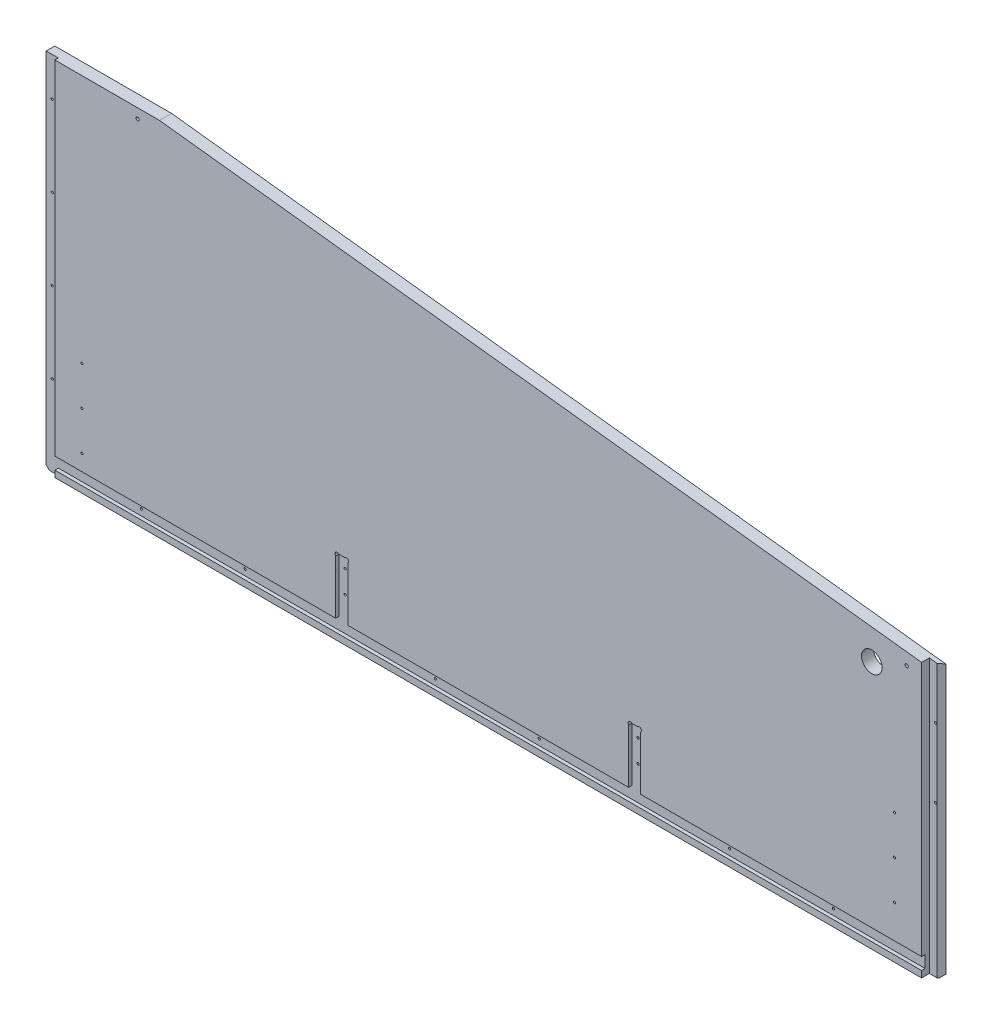
from build123d import *

# Parameters (mm, degrees)
EXTRUDE2_DEPTH     = 17.78
CUT_EXTRUDE3_DEPTH = 5.08
SKETCH9_R          = 3.301999998
SKETCH9_R_2        = 3.174999998
SKETCH9_R_3        = 3.174999999
CUT_EXTRUDE4_DEPTH = 5.08
SKETCH10_R         = 15.08125
SKETCH10_R_2       = 1.5875
CUT_EXTRUDE5_DEPTH = 17.78
SKETCH11_W         = 17.78
SKETCH11_H         = 401.3161961
CUT_EXTRUDE6_DEPTH = 11.43
CUT_EXTRUDE8_REACH = 10238.765
SKETCH15_R         = 2.38125
CUT_EXTRUDE9_DEPTH = 17.78


with BuildPart() as part:
    # Sketch7 → Extrude2 (new body)
    with BuildSketch(Plane.XY):
        Polygon((9086.320833334, -4722.091838581), (10222.970833334, -4853.78125), (10222.970833334, -5248.275), (10218.208333334, -5253.0375), (8919.633333334, -5253.0375), (8914.870833334, -5248.275), (8914.870833334, -4722.091838581), align=None)
    extrude(amount=-EXTRUDE2_DEPTH)

    # Sketch8 → Cut-Extrude3 (cut)
    with BuildSketch(Plane.XY):
        Polygon((8932.650833334, -4722.091838581), (8914.870833334, -4722.091838581), (8914.870833334, -5253.0375), (8932.650833334, -5253.0375), (8932.650833334, -5243.5125), (10222.970833334, -5243.5125), (10222.970833334, -5225.7325), (9792.864166668, -5225.7325), (9792.864166668, -5141.912499999), (9775.084166668, -5141.912499999), (9775.084166668, -5225.7325), (9362.757500002, -5225.7325), (9362.757500002, -5141.9125), (9344.977500002, -5141.912499999), (9344.977500002, -5225.7325), (8932.650833334, -5225.7325), align=None)
    extrude(amount=-CUT_EXTRUDE3_DEPTH, mode=Mode.SUBTRACT)

    # Sketch9 → Cut-Extrude4 (cut)
    with BuildSketch(Plane.XY):
        with Locations((9347.222564031, -5144.157564028)):
            Circle(SKETCH9_R)
        with Locations((9360.512435973, -5144.15756403)):
            Circle(SKETCH9_R_2)
        with Locations((9777.329230699, -5144.157564029)):
            Circle(SKETCH9_R_3)
        with Locations((9790.619102638, -5144.157564029)):
            Circle(SKETCH9_R_3)
    extrude(amount=-CUT_EXTRUDE4_DEPTH, mode=Mode.SUBTRACT)

    # Sketch10 → Cut-Extrude5 (cut)
    with BuildSketch(Plane.XY):
        with Locations((10132.081036572, -4887.549352662)):
            Circle(SKETCH10_R)
        with Locations((8923.760833334, -4778.904166666)):
            Circle(SKETCH10_R_2)
        with Locations((8923.760833334, -4897.4375)):
            Circle(SKETCH10_R_2)
        with Locations((8923.760833334, -5015.970833334)):
            Circle(SKETCH10_R_2)
        with Locations((8923.760833334, -5134.504166666)):
            Circle(SKETCH10_R_2)
        with Locations((9054.570833334, -5234.6225)):
            Circle(SKETCH10_R_2)
        with Locations((9206.970833334, -5234.6225)):
            Circle(SKETCH10_R_2)
        with Locations((9353.8675, -5193.9825)):
            Circle(SKETCH10_R_2)
        with Locations((9353.8675, -5160.9625)):
            Circle(SKETCH10_R_2)
        with Locations((9486.370833334, -5234.6225)):
            Circle(SKETCH10_R_2)
        with Locations((9638.770833334, -5234.6225)):
            Circle(SKETCH10_R_2)
        with Locations((9783.974166666, -5193.9825)):
            Circle(SKETCH10_R_2)
        with Locations((9783.974166666, -5160.9625)):
            Circle(SKETCH10_R_2)
        with Locations((9918.170833334, -5234.6225)):
            Circle(SKETCH10_R_2)
        with Locations((10070.570833334, -5234.6225)):
            Circle(SKETCH10_R_2)
        with Locations((10214.080833334, -5031.58125)):
            Circle(SKETCH10_R_2)
        with Locations((10214.080833334, -4929.98125)):
            Circle(SKETCH10_R_2)
        with Locations((8972.338333334, -5087.9375)):
            Circle(SKETCH10_R_2)
        with Locations((8972.338333334, -5145.0875)):
            Circle(SKETCH10_R_2)
        with Locations((8972.338333334, -5202.2375)):
            Circle(SKETCH10_R_2)
        with Locations((10165.503333334, -5176.8375)):
            Circle(SKETCH10_R_2)
        with Locations((10165.503333334, -5119.6875)):
            Circle(SKETCH10_R_2)
        with Locations((10165.503333334, -5062.5375)):
            Circle(SKETCH10_R_2)
    extrude(amount=-CUT_EXTRUDE5_DEPTH, mode=Mode.SUBTRACT)

    # Sketch11 → Cut-Extrude6 (cut)
    with BuildSketch(Plane.XY):
        with Locations((10214.080833334, -5052.37940195)):
            Rectangle(SKETCH11_W, SKETCH11_H)
    extrude(amount=-CUT_EXTRUDE6_DEPTH, mode=Mode.SUBTRACT)

    # Cut-Extrude8: up to this plane
    cut_extrude8_end = Plane(origin=(9086.320833334, -4722.091838581, -17.78), z_dir=(0.11508765240352697, 0.993355340381399, 0))
    # Sketch14 → Cut-Extrude8 (cut, up to the surface)
    with BuildSketch(Plane.XZ.offset(5253.0375), mode=Mode.PRIVATE) as cut_extrude8_sk1:
        Polygon((10222.970833334, -11.43), (10229.320833334, -11.43), (10222.970833334, -17.78), (10216.620833334, -11.43), align=None)
    cut_extrude8_tool1 = split(extrude(cut_extrude8_sk1.sketch, amount=-CUT_EXTRUDE8_REACH, mode=Mode.PRIVATE), bisect_by=cut_extrude8_end, keep=Keep.BOTH, mode=Mode.PRIVATE)
    add(cut_extrude8_tool1.solids().sort_by_distance((10222.970833, -5253.0375, -13.546667))[0], mode=Mode.SUBTRACT)

    # Sketch15 → Cut-Extrude9 (cut)
    with BuildSketch(Plane(origin=(0, 0, -17.78), x_dir=(-1, 0, 0), z_dir=(0, 0, -1))):
        with Locations((-10183.334449276, -4866.940983559)):
            Circle(SKETCH15_R)
        with Locations((-9054.237101631, -4736.126603455)):
            Circle(SKETCH15_R)
    extrude(amount=-CUT_EXTRUDE9_DEPTH, mode=Mode.SUBTRACT)


solid = part.part
